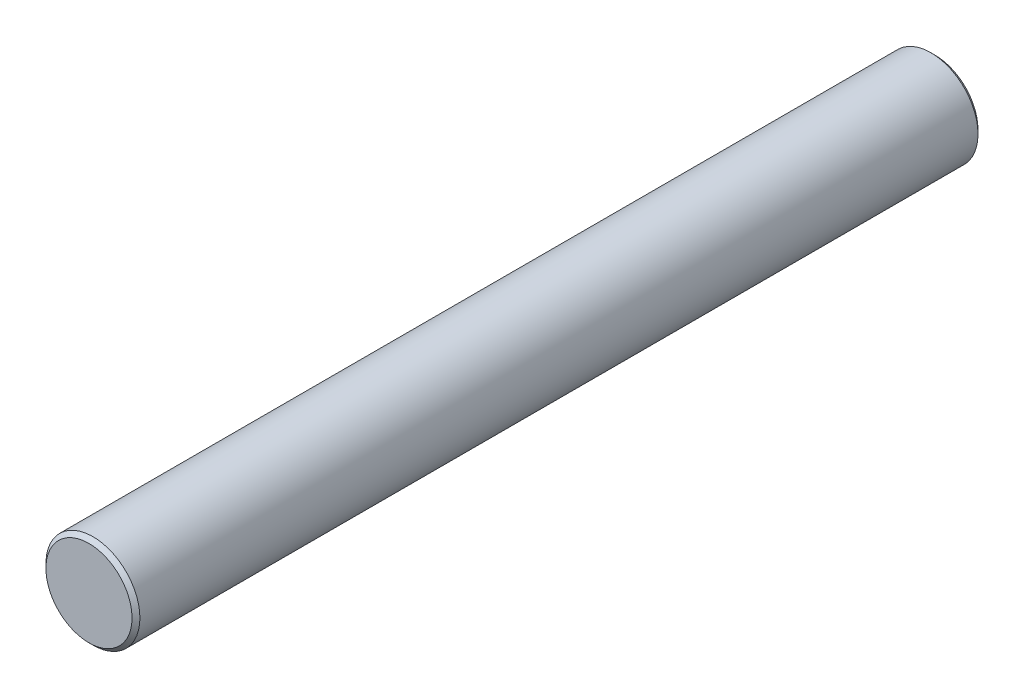
from build123d import *

# Parameters (mm, degrees)
SKETCH1_R           = 4.7625
BOSS_EXTRUDE1_DEPTH = 85.725
CHAMFER1_SIZE       = 0.4


with BuildPart() as part:
    # Sketch1 → Boss-Extrude1 (new body)
    with BuildSketch(Plane.XY):
        Circle(SKETCH1_R)
    extrude(amount=BOSS_EXTRUDE1_DEPTH)

    # Chamfer1
    chamfer1_edges = [part.edges().sort_by_distance(p)[0] for p in [
        (-4.7625, 0, 0),
        (-4.7625, 0, 85.725),
    ]]
    chamfer(chamfer1_edges, length=CHAMFER1_SIZE)


solid = part.part
